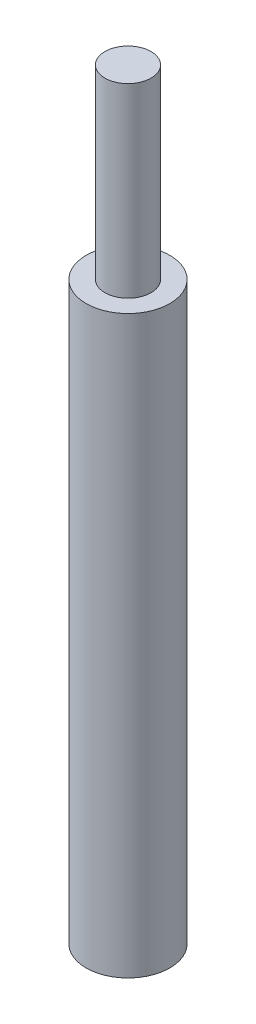
from build123d import *

# Parameters (mm, degrees)
SKETCH1_R                  = 7.14375
BOSS_EXTRUDE1_DEPTH        = 130.048
M10X1_0_TAPPED_HOLE1_D     = 9
M10X1_0_TAPPED_HOLE1_DEPTH = 15
M10X1_0_TAPPED_HOLE1_TIP   = 2.703872786
CUT_EXTRUDE1_START         = -31.75
SKETCH4_R                  = 7.14375
SKETCH4_R_2                = 3.937
CUT_EXTRUDE1_DEPTH         = 31.75


with BuildPart() as part:
    # Sketch1 → Boss-Extrude1 (new body)
    with BuildSketch(Plane(origin=(0, 0, 0), x_dir=(1, 0, 0), z_dir=(0, 1, 0))):
        with Locations(Location((0, 0, 0), (0, 0, 270))):
            Circle(SKETCH1_R)
    extrude(amount=BOSS_EXTRUDE1_DEPTH)

    # M10x1.0 Tapped Hole1
    with Locations(Plane.XZ):
        with Locations((0, 0)):
            Hole(M10X1_0_TAPPED_HOLE1_D / 2, depth=M10X1_0_TAPPED_HOLE1_DEPTH)
            with Locations((0, 0, -(M10X1_0_TAPPED_HOLE1_DEPTH + M10X1_0_TAPPED_HOLE1_TIP / 2))):  # 118° drill point
                Cone(0, M10X1_0_TAPPED_HOLE1_D / 2, M10X1_0_TAPPED_HOLE1_TIP, mode=Mode.SUBTRACT)

    # Sketch4 → Cut-Extrude1 (cut)
    with BuildSketch(Plane(origin=(0, 130.048, 0), x_dir=(1, 0, 0), z_dir=(0, 1, 0)).offset(CUT_EXTRUDE1_START)):
        with Locations(Location((0, 0, 0), (0, 0, 270))):
            Circle(SKETCH4_R)
        with Locations(Location((0, 0, 0), (0, 0, 270))):
            Circle(SKETCH4_R_2, mode=Mode.SUBTRACT)
    extrude(amount=CUT_EXTRUDE1_DEPTH, mode=Mode.SUBTRACT)


solid = part.part
